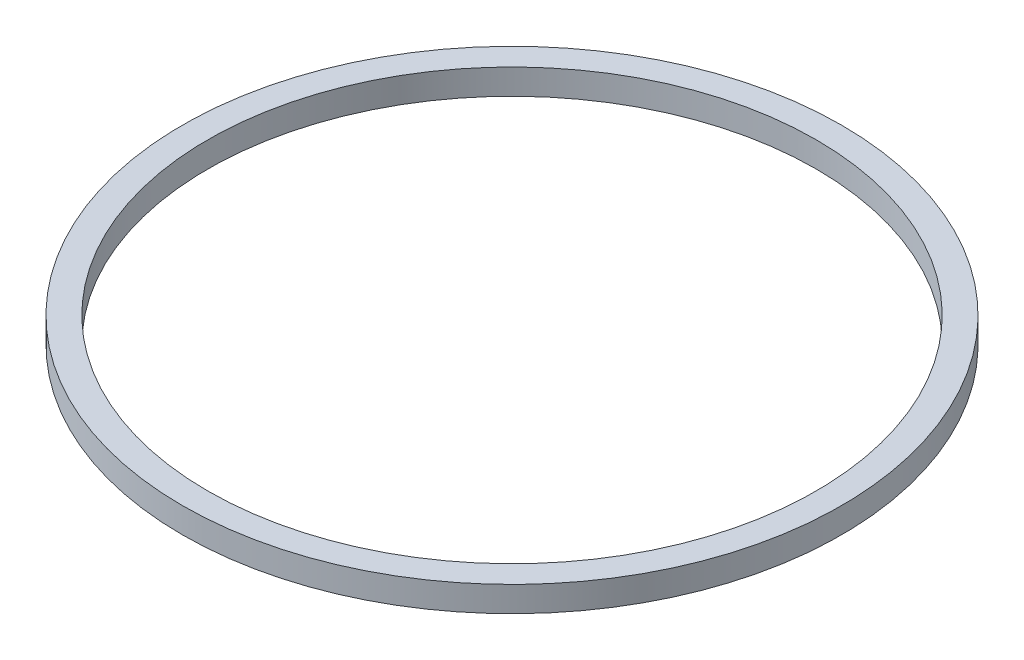
from build123d import *

# Parameters (mm, degrees)
SKETCH1_R           = 13
SKETCH1_R_2         = 12
BOSS_EXTRUDE1_DEPTH = 1


with BuildPart() as part:
    # Sketch1 → Boss-Extrude1 (new body)
    with BuildSketch(Plane(origin=(0, 0, 0), x_dir=(1, 0, 0), z_dir=(0, 1, 0))):
        with Locations(Location((0, 0, 0), (0, 0, 270))):
            Circle(SKETCH1_R)
        with Locations(Location((0, 0, 0), (0, 0, 270))):
            Circle(SKETCH1_R_2, mode=Mode.SUBTRACT)
    extrude(amount=BOSS_EXTRUDE1_DEPTH)


solid = part.part
